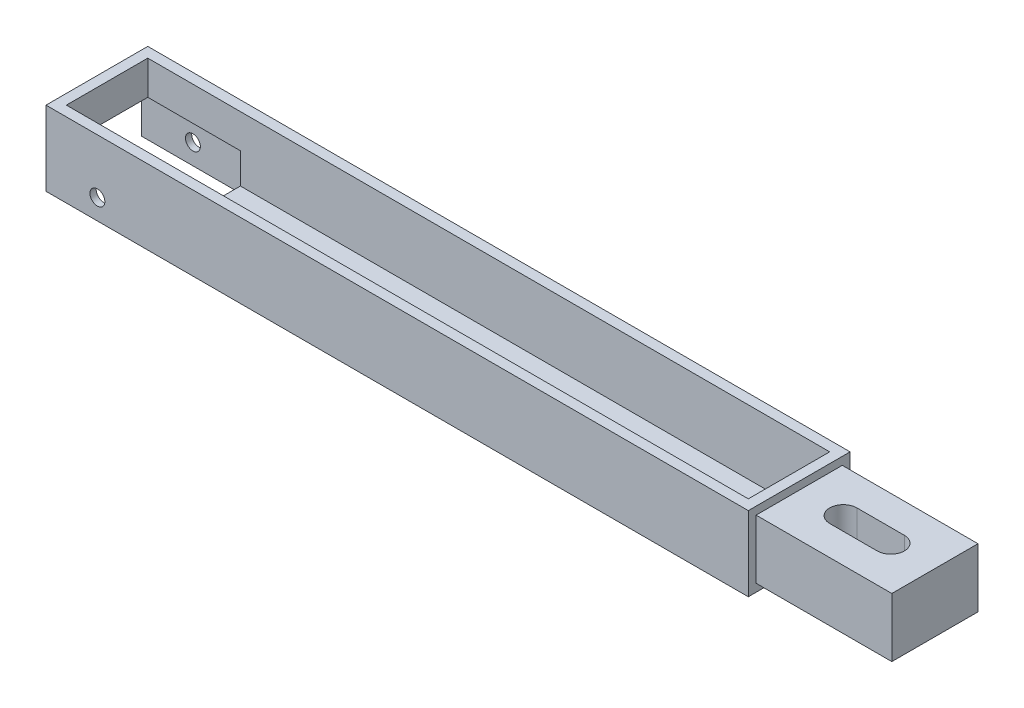
from build123d import *

# Parameters (mm, degrees)
SKETCH1_W           = 207
SKETCH1_H           = 30
BOSS_EXTRUDE1_DEPTH = 22
SHELL1_T            = -3
SKETCH2_W           = 207
SKETCH2_H           = 10
CUT_EXTRUDE1_DEPTH  = 3
SKETCH3_W           = 30.3
SKETCH3_H           = 26.3
CUT_EXTRUDE2_DEPTH  = 12
SKETCH4_R           = 2.2
CUT_EXTRUDE3_DEPTH  = 110.982953225
SKETCH5_W           = 25.4
SKETCH5_H           = 17.4
BOSS_EXTRUDE2_DEPTH = 40
CUT_EXTRUDE4_DEPTH  = 146.620534266


with BuildPart() as part:
    # Sketch1 → Boss-Extrude1 (new body)
    with BuildSketch(Plane(origin=(0, 0, 0), x_dir=(1, 0, 0), z_dir=(0, 1, 0))):
        Rectangle(SKETCH1_W, SKETCH1_H)
    extrude(amount=BOSS_EXTRUDE1_DEPTH)

    # Shell1
    shell1_openings = [part.faces().sort_by_distance(p)[0] for p in [
        (0, 22, 0),
    ]]
    offset(amount=SHELL1_T, openings=shell1_openings, kind=Kind.INTERSECTION)

    # Sketch2 → Cut-Extrude1 (cut)
    with BuildSketch(Plane(origin=(0, 0, 0), x_dir=(-1, 0, 0), z_dir=(0, -1, 0))):
        Rectangle(SKETCH2_W, SKETCH2_H)
    extrude(amount=-CUT_EXTRUDE1_DEPTH, mode=Mode.SUBTRACT)

    # Sketch3 → Cut-Extrude2 (cut)
    with BuildSketch(Plane(origin=(0, 0, 0), x_dir=(-1, 0, 0), z_dir=(0, -1, 0))):
        with Locations((88.35, 0)):
            Rectangle(SKETCH3_W, SKETCH3_H)
    extrude(amount=-CUT_EXTRUDE2_DEPTH, mode=Mode.SUBTRACT)

    # Sketch4 → Cut-Extrude3 (cut, through all)
    with BuildSketch(Plane.XY.offset(15)):
        with Locations((-88.35, 6)):
            Circle(SKETCH4_R)
    extrude(amount=-CUT_EXTRUDE3_DEPTH, mode=Mode.SUBTRACT)

    # Sketch5 → Boss-Extrude2 (add)
    with BuildSketch(Plane(origin=(103.5, 0, 0), x_dir=(0, 0, -1), z_dir=(1, 0, 0))):
        with Locations((0, 11)):
            Rectangle(SKETCH5_W, SKETCH5_H)
    extrude(amount=BOSS_EXTRUDE2_DEPTH)

    # Sketch6 → Cut-Extrude4 (cut, through all)
    with BuildSketch(Plane(origin=(0, 19.7, 0), x_dir=(1, 0, 0), z_dir=(0, 1, 0))):
        with BuildLine():
            Line((116.5, 4), (130.5, 4))
            ThreePointArc((130.5, 4), (134.5, 0), (130.5, -4))
            Line((130.5, -4), (116.5, -4))
            ThreePointArc((116.5, -4), (112.5, 0), (116.5, 4))
        make_face()
    extrude(amount=-CUT_EXTRUDE4_DEPTH, mode=Mode.SUBTRACT)


solid = part.part
